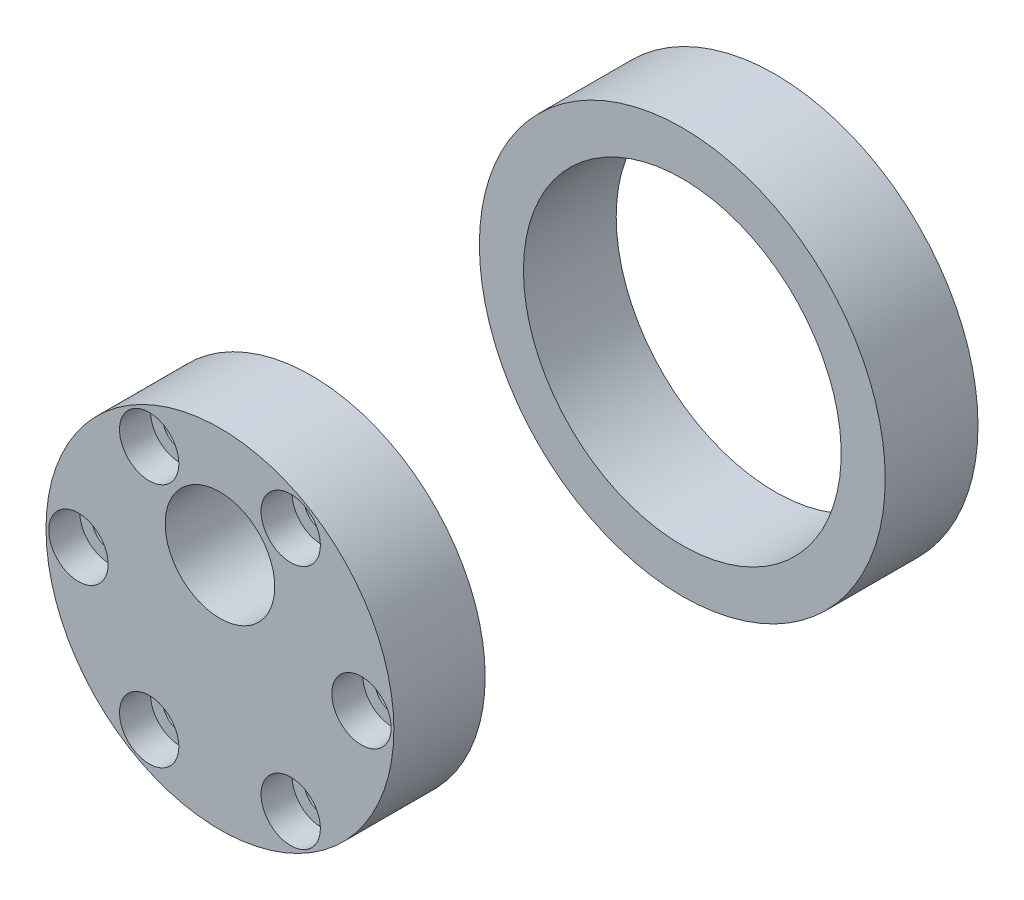
from build123d import *

# Parameters (mm, degrees)
SKETCH1_R                                           = 19.05
SKETCH1_R_2                                         = 6
SKETCH1_R_3                                         = 1.905
FACE_PLATE_DEPTH                                    = 10
CBORE_FOR_M3_HEX_SOCKET_HEAD_CAP_SCREW1_D           = 3.4
CBORE_FOR_M3_HEX_SOCKET_HEAD_CAP_SCREW1_CBORE_D     = 6.5
CBORE_FOR_M3_HEX_SOCKET_HEAD_CAP_SCREW1_CBORE_DEPTH = 3.4
SKETCH5_R                                           = 22.225
SKETCH5_R_2                                         = 17.4
BOSS_EXTRUDE1_DEPTH                                 = 10.16


with BuildPart() as part:
    # Sketch1 → Face Plate (new body)
    with BuildSketch(Plane.XY):
        Circle(SKETCH1_R)
        with Locations((0, 7)):
            Circle(SKETCH1_R_2, mode=Mode.SUBTRACT)
        with Locations((15.5, 0)):
            Circle(SKETCH1_R_3, mode=Mode.SUBTRACT)
        with Locations((7.75, -13.423393759)):
            Circle(SKETCH1_R_3, mode=Mode.SUBTRACT)
        with Locations((-7.75, -13.423393759)):
            Circle(SKETCH1_R_3, mode=Mode.SUBTRACT)
        with Locations((-15.5, 0)):
            Circle(SKETCH1_R_3, mode=Mode.SUBTRACT)
        with Locations((-7.75, 13.423393759)):
            Circle(SKETCH1_R_3, mode=Mode.SUBTRACT)
        with Locations((7.75, 13.423393759)):
            Circle(SKETCH1_R_3, mode=Mode.SUBTRACT)
    extrude(amount=FACE_PLATE_DEPTH)

    # CBORE for M3 Hex Socket Head Cap Screw1 (through all)
    with Locations(Plane.XY.offset(10)):
        with Locations((7.75, -13.423393759), (-7.75, -13.423393759), (-15.5, 0), (-7.75, 13.423393759), (7.75, 13.423393759), (15.5, 0)):
            CounterBoreHole(CBORE_FOR_M3_HEX_SOCKET_HEAD_CAP_SCREW1_D / 2, CBORE_FOR_M3_HEX_SOCKET_HEAD_CAP_SCREW1_CBORE_D / 2, CBORE_FOR_M3_HEX_SOCKET_HEAD_CAP_SCREW1_CBORE_DEPTH)


with BuildPart() as body_2:
    # Sketch5 → Boss-Extrude1 (new body)
    with BuildSketch(Plane(origin=(0, 0, -40.64), x_dir=(-1, 0, 0), z_dir=(0, 0, -1))):
        Circle(SKETCH5_R)
        Circle(SKETCH5_R_2, mode=Mode.SUBTRACT)
    extrude(amount=BOSS_EXTRUDE1_DEPTH)


solid = Compound([part.part, body_2.part])
